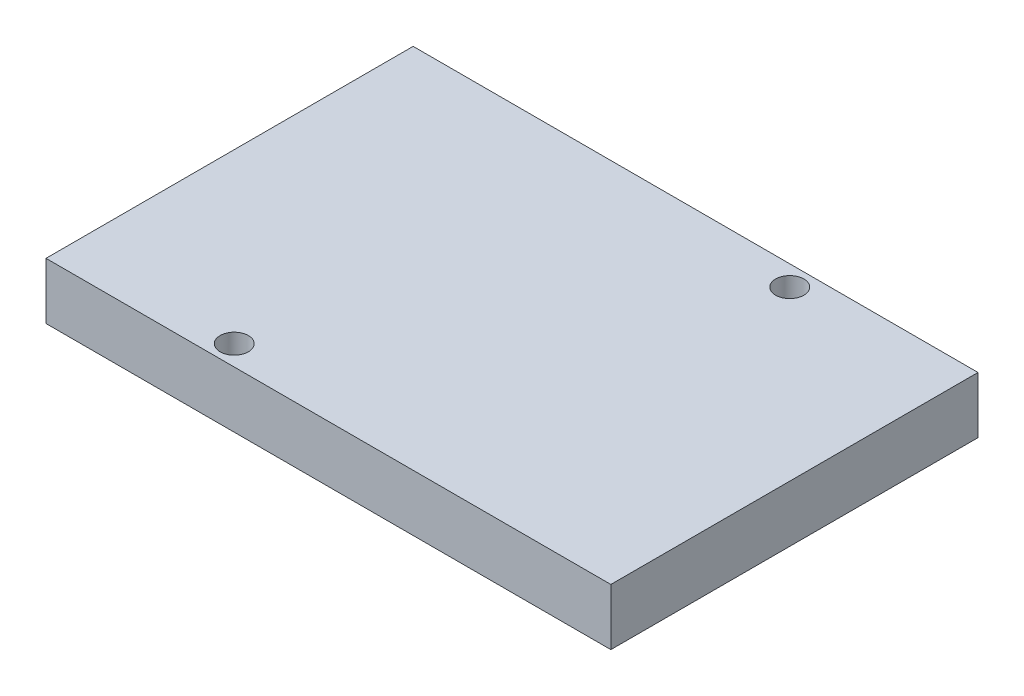
from build123d import *

# Parameters (mm, degrees)
SKETCH1_W           = 100
SKETCH1_H           = 65
BOSS_EXTRUDE1_DEPTH = 10
SKETCH2_R           = 2.5
CUT_EXTRUDE1_DEPTH  = 10
SKETCH3_R           = 2.5
CUT_EXTRUDE2_DEPTH  = 4


with BuildPart() as part:
    # Sketch1 → Boss-Extrude1 (new body)
    with BuildSketch(Plane(origin=(0, 0, 0), x_dir=(1, 0, 0), z_dir=(0, 1, 0))):
        with Locations((50, 32.5)):
            Rectangle(SKETCH1_W, SKETCH1_H)
    extrude(amount=BOSS_EXTRUDE1_DEPTH)

    # Sketch2 → Cut-Extrude1 (cut)
    with BuildSketch(Plane(origin=(0, 0, -65), x_dir=(-1, 0, 0), z_dir=(0, 0, -1))):
        with Locations((-59, 5)):
            Circle(SKETCH2_R)
        with Locations((-41, 5)):
            Circle(SKETCH2_R)
    extrude(amount=-CUT_EXTRUDE1_DEPTH, mode=Mode.SUBTRACT)

    # Sketch3 → Cut-Extrude2 (cut)
    with BuildSketch(Plane(origin=(0, 10, 0), x_dir=(1, 0, 0), z_dir=(0, 1, 0))):
        with Locations(Location((29.75, 3.575, 0), (0, 0, 270))):
            Circle(SKETCH3_R)
        with Locations(Location((70.25, 61.425, 0), (0, 0, 270))):
            Circle(SKETCH3_R)
    extrude(amount=-CUT_EXTRUDE2_DEPTH, mode=Mode.SUBTRACT)


solid = part.part
